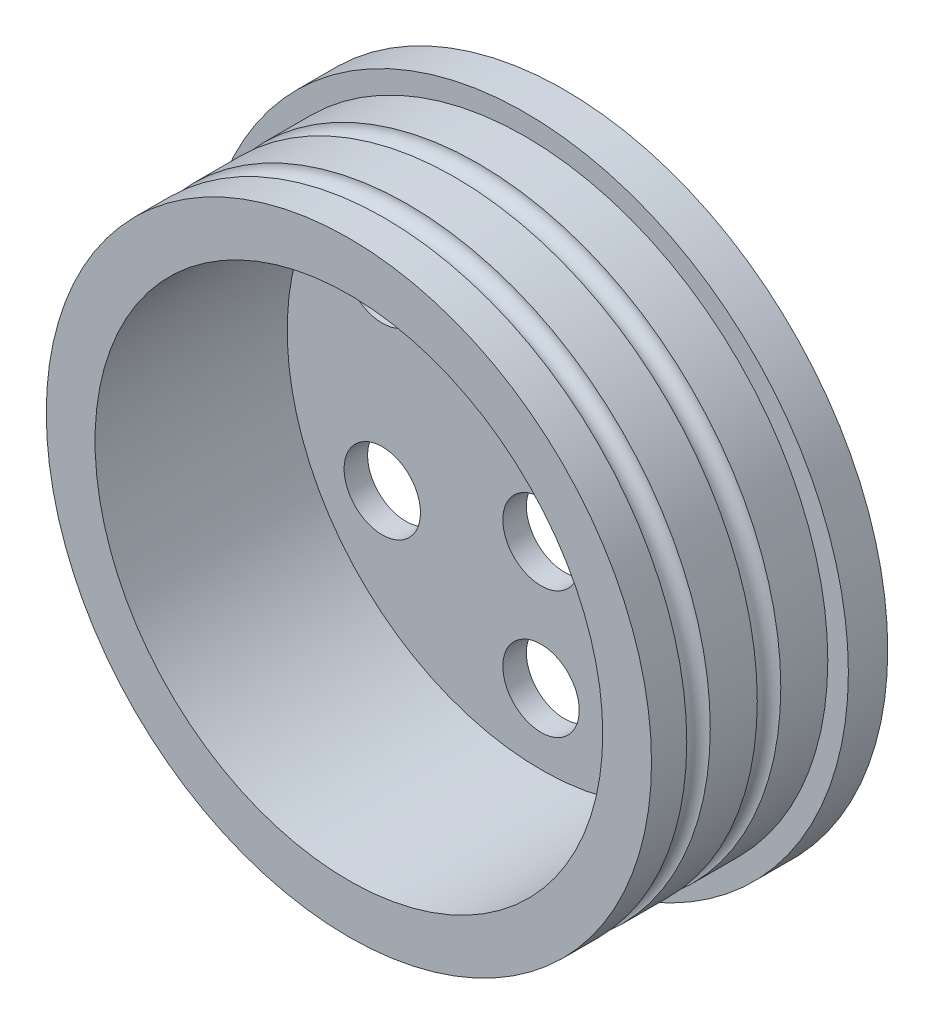
from build123d import *

# Parameters (mm, degrees)
CROQUIS1_R                    = 55
SALIENTE_EXTRUIR1_DEPTH       = 6.7
CROQUIS2_R                    = 51.5
SALIENTE_EXTRUIR2_DEPTH       = 30
CROQUIS3_R                    = 2
CROQUIS4_R                    = 43.2
CORTAR_EXTRUIR1_DEPTH         = 32.7
TALADRO_DE_MARGEN_PARA_M121_D = 13
MATRIZC1_COUNT                = 6
TALADRO_DE_MARGEN_PARA_M122_D = 13


with BuildPart() as part:
    # Croquis1 → Saliente-Extruir1 (new body)
    with BuildSketch(Plane.XY):
        Circle(CROQUIS1_R)
    extrude(amount=SALIENTE_EXTRUIR1_DEPTH)

    # Croquis2 → Saliente-Extruir2 (add)
    with BuildSketch(Plane.XY.offset(6.7)):
        Circle(CROQUIS2_R)
    extrude(amount=SALIENTE_EXTRUIR2_DEPTH)

    # Croquis3 → Cortar-Revolución1 (revolve, cut)
    with BuildSketch(Plane(origin=(0, 0, 0), x_dir=(1, 0, 0), z_dir=(0, 1, 0)), mode=Mode.PRIVATE) as cortar_revoluci_n1_sk:
        with Locations((-51.5, -16.7)):
            Circle(CROQUIS3_R)
        with Locations((-51.5, -28.7)):
            Circle(CROQUIS3_R)
    revolve(cortar_revoluci_n1_sk.sketch.rotate(Axis((0, 0, 36.878025431), (0, 0, -1)), 180), axis=Axis((0, 0, 36.878025431), (0, 0, -1)), mode=Mode.SUBTRACT)

    # Croquis4 → Cortar-Extruir1 (cut)
    with BuildSketch(Plane.XY.offset(36.7)):
        Circle(CROQUIS4_R)
    extrude(amount=-CORTAR_EXTRUIR1_DEPTH, mode=Mode.SUBTRACT)

    # Taladro de margen para M121 (through all)
    with Locations(Plane(origin=(0, 0, 0), x_dir=(-1, 0, 0), z_dir=(0, 0, -1))):
        with Locations((0, 31.2)):
            taladro_de_margen_para_m121 = Hole(TALADRO_DE_MARGEN_PARA_M121_D / 2)

    # MatrizC1: Taladro de margen para M121 ×6 about axis
    matrizc1_axis = Axis((0, 0, 0), (0, 0, 1))
    for i in range(1, MATRIZC1_COUNT):
        add(taladro_de_margen_para_m121.rotate(matrizc1_axis, i * 360 / MATRIZC1_COUNT), mode=Mode.SUBTRACT)

    # Taladro de margen para M122 (through all)
    with Locations(Plane(origin=(0, 0, 0), x_dir=(-1, 0, 0), z_dir=(0, 0, -1))):
        with Locations((0, -9.6)):
            taladro_de_margen_para_m122 = Hole(TALADRO_DE_MARGEN_PARA_M122_D / 2)

    # Simetría1: Taladro de margen para M122 across plane
    add(taladro_de_margen_para_m122.mirror(Plane.ZX), mode=Mode.SUBTRACT)


solid = part.part
